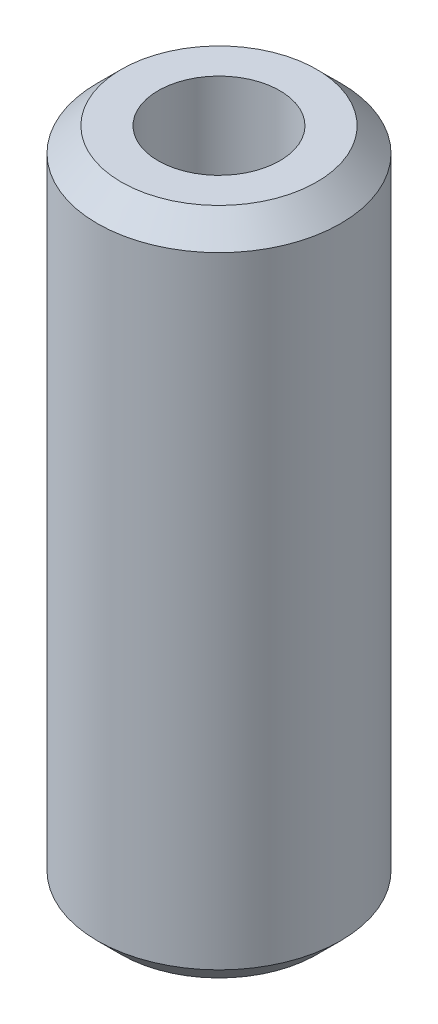
from build123d import *

# Parameters (mm, degrees)
SKETCH1_R           = 12.7
SKETCH1_R_2         = 6.35
BOSS_EXTRUDE1_DEPTH = 34.925
CHAMFER1_SIZE       = 2.5
SCALE1_SCALE        = 0.51948


with BuildPart() as part:
    # Sketch1 → Boss-Extrude1 (new, symmetric)
    with BuildSketch(Plane(origin=(0, 0, 0), x_dir=(1, 0, 0), z_dir=(0, 1, 0))):
        with Locations(Location((0, 0, 0), (0, 0, 270))):
            Circle(SKETCH1_R)
        with Locations(Location((0, 0, 0), (0, 0, 270))):
            Circle(SKETCH1_R_2, mode=Mode.SUBTRACT)
    extrude(amount=BOSS_EXTRUDE1_DEPTH, both=True)

    # Chamfer1
    chamfer1_edges = [part.edges().sort_by_distance(p)[0] for p in [
        (0, -34.925, -12.7),
        (0, 34.925, -12.7),
    ]]
    chamfer(chamfer1_edges, length=CHAMFER1_SIZE)


with BuildPart() as part_1:
    # Scale1: scaled about (0, 0, 0)
    add(part.part.scale(SCALE1_SCALE))


solid = part_1.part
